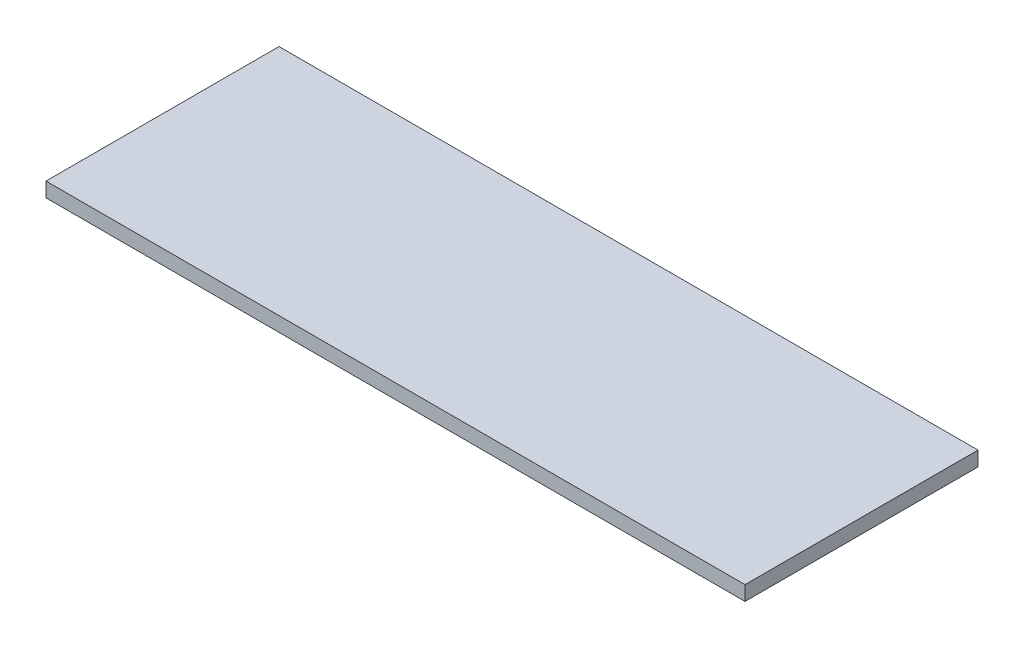
from build123d import *

# Parameters (mm, degrees)
SKETCH1_W           = 76.2
SKETCH1_H           = 25.4
BOSS_EXTRUDE1_DEPTH = 1.5875


with BuildPart() as part:
    # Sketch1 → Boss-Extrude1 (new body)
    with BuildSketch(Plane(origin=(0, 0, 0), x_dir=(1, 0, 0), z_dir=(0, 1, 0))):
        with Locations((38.1, 12.7)):
            Rectangle(SKETCH1_W, SKETCH1_H)
    extrude(amount=BOSS_EXTRUDE1_DEPTH)


solid = part.part
